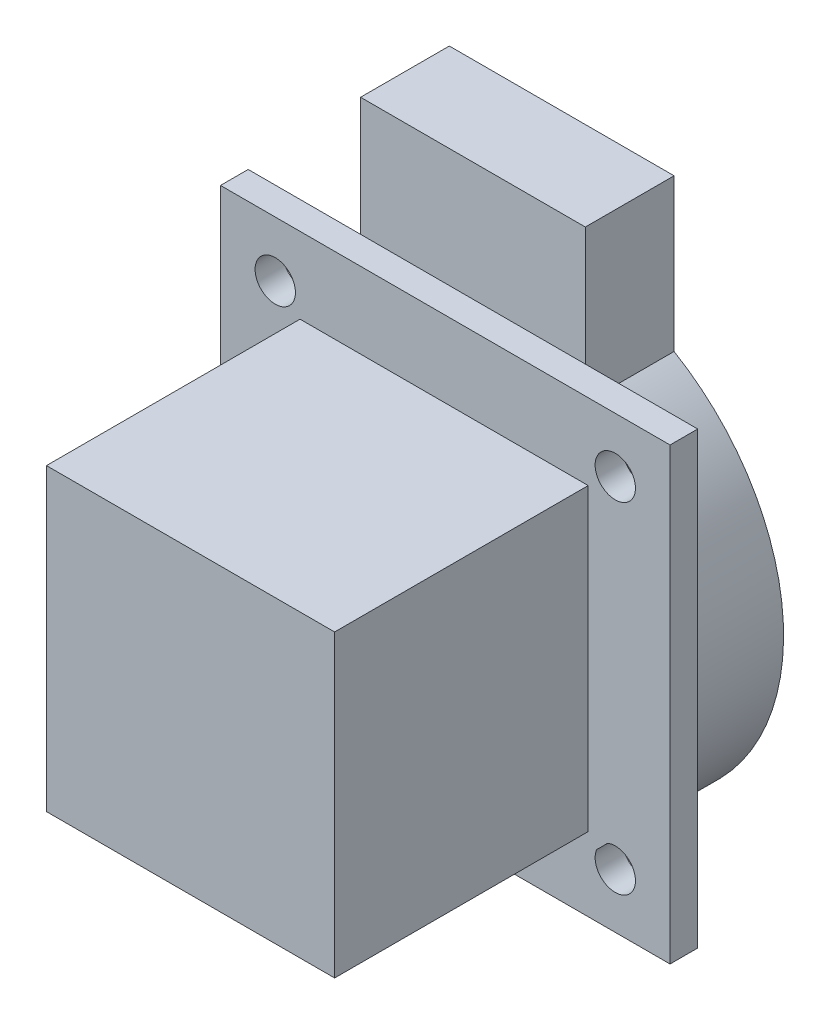
from build123d import *

# Parameters (mm, degrees)
SKETCH1_W           = 49.53
SKETCH1_H           = 49.53
BOSS_EXTRUDE1_DEPTH = 3.048
SKETCH2_R           = 24.4475
BOSS_EXTRUDE2_DEPTH = 9.779
CUT_EXTRUDE1_START  = -9.779
SKETCH3_R           = 2.2225
CUT_EXTRUDE1_DEPTH  = 9.779
SKETCH4_W           = 31.75
SKETCH4_H           = 33.02
BOSS_EXTRUDE3_DEPTH = 27.94


with BuildPart() as part:
    # Sketch1 → Boss-Extrude1 (new body)
    with BuildSketch(Plane.XY):
        with Locations((24.765, 24.765)):
            Rectangle(SKETCH1_W, SKETCH1_H)
    extrude(amount=BOSS_EXTRUDE1_DEPTH)

    # Sketch2 → Boss-Extrude2 (add)
    with BuildSketch(Plane(origin=(0, 0, 0), x_dir=(-1, 0, 0), z_dir=(0, 0, -1))):
        Polygon((-37.1475, 49.53), (-24.765, 49.53), (-12.3825, 49.53), (-12.3825, 62.611), (-37.1475, 62.611), align=None)
        with BuildLine():
            Line((-12.3825, 49.53), (-24.765, 49.53))
            Line((-24.765, 49.53), (-37.1475, 49.53))
            Line((-37.1475, 49.53), (-37.1475, 45.844704694))
            ThreePointArc((-37.1475, 45.844704694), (-24.765, 49.2125), (-12.3825, 45.844704694))
            Line((-12.3825, 45.844704694), (-12.3825, 49.53))
        make_face()
        with Locations((-24.765, 24.765)):
            Circle(SKETCH2_R)
    extrude(amount=BOSS_EXTRUDE2_DEPTH)

    # Sketch3 → Cut-Extrude1 (cut)
    with BuildSketch(Plane(origin=(0, 0, 0), x_dir=(-1, 0, 0), z_dir=(0, 0, -1)).offset(CUT_EXTRUDE1_START)):
        with BuildLine():
            ThreePointArc((-41.449545605, 6.895859165), (-42.051993033, 7.478006967), (-42.634140835, 8.080454395))
            ThreePointArc((-42.634140835, 8.080454395), (-44.726461046, 7.884299394), (-45.72, 6.0325))
            Line((-45.72, 6.0325), (-43.4975, 6.0325))
            Line((-43.4975, 6.0325), (-43.4975, 3.81))
            ThreePointArc((-43.4975, 3.81), (-41.925955179, 4.460955179), (-41.275, 6.0325))
            ThreePointArc((-41.275, 6.0325), (-41.319073401, 6.472913219), (-41.449545605, 6.895859165))
        make_face()
        with BuildLine():
            Line((-43.4975, 6.0325), (-45.72, 6.0325))
            ThreePointArc((-45.72, 6.0325), (-45.069044821, 4.460955179), (-43.4975, 3.81))
            Line((-43.4975, 3.81), (-43.4975, 6.0325))
        make_face()
        with BuildLine():
            ThreePointArc((-6.859133168, 8.119874911), (-7.507381573, 7.448682191), (-8.180771601, 6.802716608))
            ThreePointArc((-8.180771601, 6.802716608), (-7.919638213, 4.762126071), (-6.096, 3.81))
            Line((-6.096, 3.81), (-6.096, 6.0325))
            Line((-6.096, 6.0325), (-3.8735, 6.0325))
            ThreePointArc((-3.8735, 6.0325), (-4.822531747, 7.853978756), (-6.859133168, 8.119874911))
        make_face()
        with BuildLine():
            Line((-6.096, 6.0325), (-6.096, 3.81))
            ThreePointArc((-6.096, 3.81), (-4.524455179, 4.460955179), (-3.8735, 6.0325))
            Line((-3.8735, 6.0325), (-6.096, 6.0325))
        make_face()
        with Locations((-6.0325, 43.434)):
            Circle(SKETCH3_R)
        with Locations((-43.4975, 43.4975)):
            Circle(SKETCH3_R)
    extrude(amount=CUT_EXTRUDE1_DEPTH, mode=Mode.SUBTRACT)

    # Sketch4 → Boss-Extrude3 (add)
    with BuildSketch(Plane.XY.offset(3.048)):
        with Locations((24.638, 24.638)):
            Rectangle(SKETCH4_W, SKETCH4_H)
    extrude(amount=BOSS_EXTRUDE3_DEPTH)


solid = part.part
